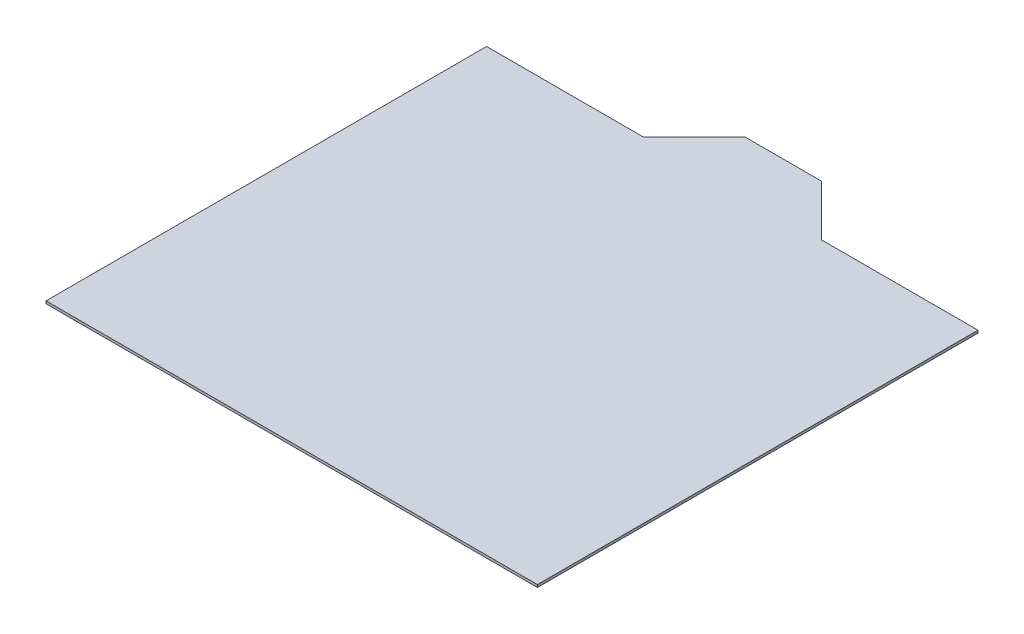
from build123d import *

# Parameters (mm, degrees)
SKETCH1_W           = 290
SKETCH1_H           = 260
BOSS_EXTRUDE1_DEPTH = 1.5


with BuildPart() as part:
    # Sketch1 → Boss-Extrude1 (new body)
    with BuildSketch(Plane(origin=(0, 0, 0), x_dir=(1, 0, 0), z_dir=(0, 1, 0))):
        Rectangle(SKETCH1_W, SKETCH1_H)
        Polygon((-52.5, 130), (0, 130), (0, 160), (-22.5, 160), align=None)
        Polygon((0, 160), (0, 130), (52.5, 130), (22.5, 160), align=None)
    extrude(amount=BOSS_EXTRUDE1_DEPTH)


solid = part.part
